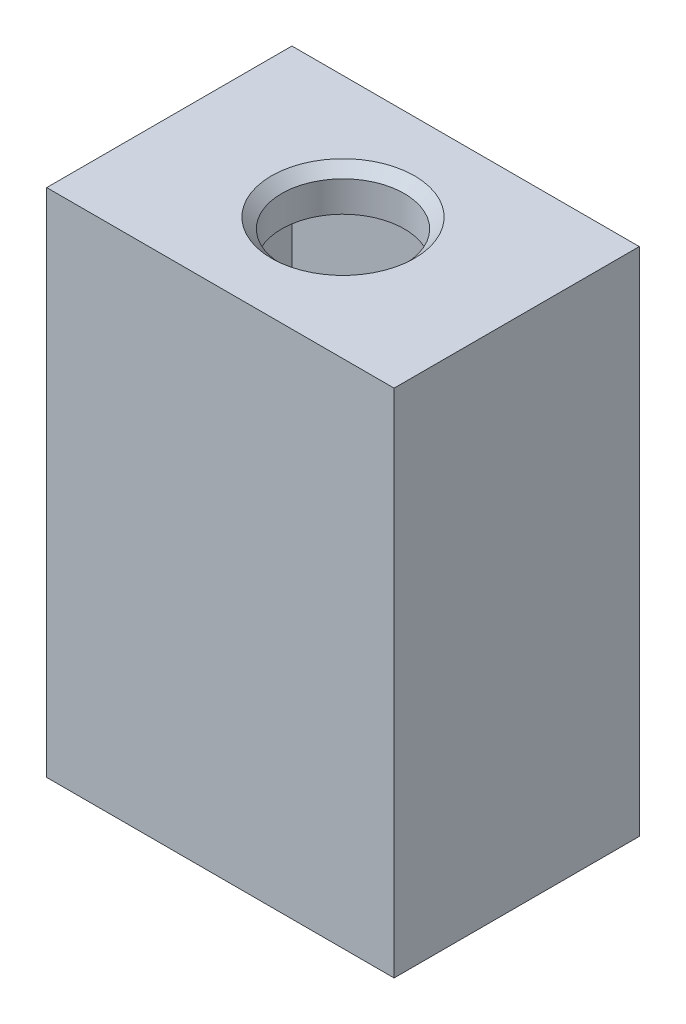
from build123d import *

# Parameters (mm, degrees)
SKETCH1_W           = 17
SKETCH1_H           = 12
SKETCH1_R           = 3
BOSS_EXTRUDE1_DEPTH = 2
SKETCH2_W           = 17
SKETCH2_H           = 12
SKETCH2_W_2         = 14
SKETCH2_H_2         = 9
BOSS_EXTRUDE2_DEPTH = 23
CHAMFER1_SIZE       = 0.5


with BuildPart() as part:
    # Sketch1 → Boss-Extrude1 (new body)
    with BuildSketch(Plane(origin=(0, 0, 0), x_dir=(1, 0, 0), z_dir=(0, 1, 0))):
        Rectangle(SKETCH1_W, SKETCH1_H)
        with Locations(Location((0, 0, 0), (0, 0, 270))):
            Circle(SKETCH1_R, mode=Mode.SUBTRACT)
    extrude(amount=BOSS_EXTRUDE1_DEPTH)

    # Sketch2 → Boss-Extrude2 (add)
    with BuildSketch(Plane(origin=(0, 0, 0), x_dir=(1, 0, 0), z_dir=(0, 1, 0))):
        Rectangle(SKETCH2_W, SKETCH2_H)
        Rectangle(SKETCH2_W_2, SKETCH2_H_2, mode=Mode.SUBTRACT)
    extrude(amount=-BOSS_EXTRUDE2_DEPTH)

    # Chamfer1
    chamfer1_edges = [part.edges().sort_by_distance(p)[0] for p in [
        (0, 2, -3),
    ]]
    chamfer(chamfer1_edges, length=CHAMFER1_SIZE)


solid = part.part
